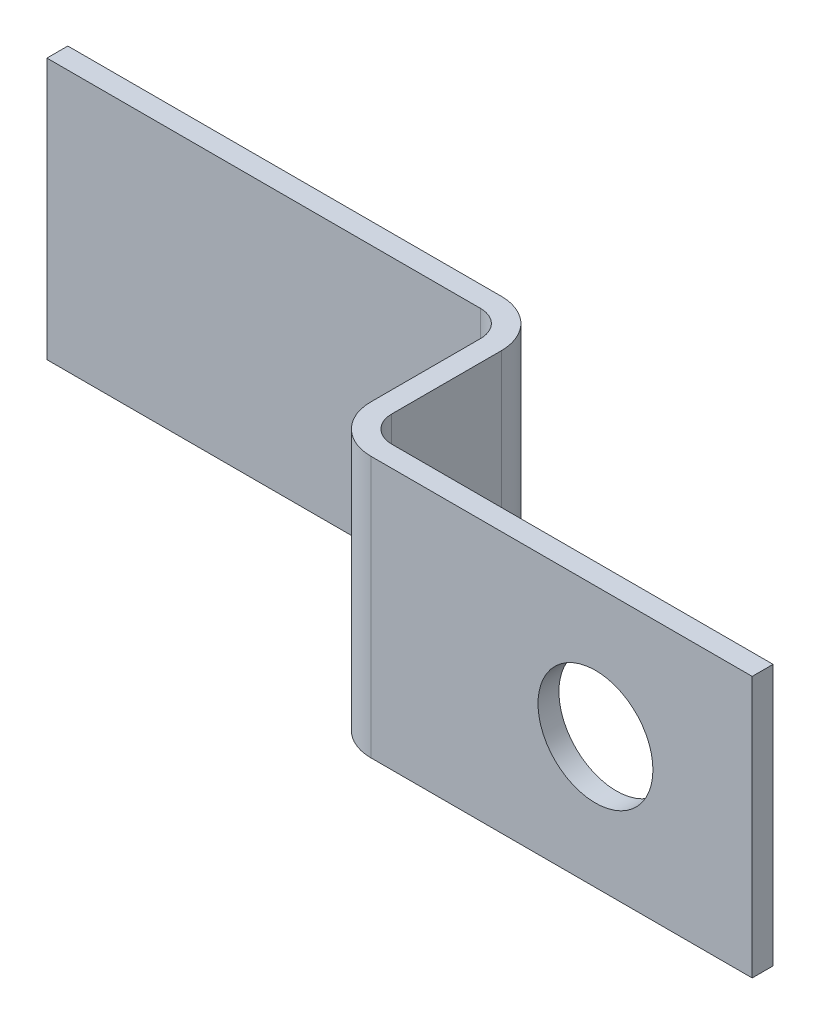
from build123d import *

# Parameters (mm, degrees)
SKETCH1_W           = 34
SKETCH1_H           = 10
BOSS_EXTRUDE1_DEPTH = 7.8
SKETCH2_W           = 15.6
SKETCH2_H           = 7
CUT_EXTRUDE1_DEPTH  = 63.432123894
SKETCH3_W           = 17.6
SKETCH3_H           = 7
CUT_EXTRUDE2_DEPTH  = 63.432123894
HOLE1_D             = 4.4
HOLE1_DEPTH         = 7.8
FILLET1_R           = 1
FILLET2_R           = 1
FILLET3_R           = 1.8
FILLET4_R           = 1.8


with BuildPart() as part:
    # Sketch1 → Boss-Extrude1 (new body)
    with BuildSketch(Plane.XY.offset(4.484761641)):
        with Locations((-44.46264725, 0)):
            Rectangle(SKETCH1_W, SKETCH1_H)
    extrude(amount=-BOSS_EXTRUDE1_DEPTH)

    # Sketch2 → Cut-Extrude1 (cut, through all)
    with BuildSketch(Plane(origin=(0, 5, 0), x_dir=(-1, 0, 0), z_dir=(0, 1, 0))):
        with Locations((35.26264725, 0.184761641)):
            Rectangle(SKETCH2_W, SKETCH2_H)
    extrude(amount=-CUT_EXTRUDE1_DEPTH, mode=Mode.SUBTRACT)

    # Sketch3 → Cut-Extrude2 (cut, through all)
    with BuildSketch(Plane(origin=(0, 5, 0), x_dir=(-1, 0, 0), z_dir=(0, 1, 0))):
        with Locations((52.66264725, 0.984761641)):
            Rectangle(SKETCH3_W, SKETCH3_H)
    extrude(amount=-CUT_EXTRUDE2_DEPTH, mode=Mode.SUBTRACT)

    # Hole1
    with Locations(Plane.XY.offset(4.484761641)):
        with Locations((-33.46264725, 0)):
            Hole(HOLE1_D / 2, depth=HOLE1_DEPTH)

    # Fillet1
    fillet1_edges = [part.edges().sort_by_distance(p)[0] for p in [
        (-43.06264725, 0, 3.684761641),
    ]]
    fillet(fillet1_edges, radius=FILLET1_R)

    # Fillet2
    fillet2_edges = [part.edges().sort_by_distance(p)[0] for p in [
        (-43.86264725, 0, -2.515238359),
    ]]
    fillet(fillet2_edges, radius=FILLET2_R)

    # Fillet3
    fillet3_edges = [part.edges().sort_by_distance(p)[0] for p in [
        (-43.06264725, 0, -3.315238359),
    ]]
    fillet(fillet3_edges, radius=FILLET3_R)

    # Fillet4
    fillet4_edges = [part.edges().sort_by_distance(p)[0] for p in [
        (-43.86264725, 0, 4.484761641),
    ]]
    fillet(fillet4_edges, radius=FILLET4_R)


solid = part.part
